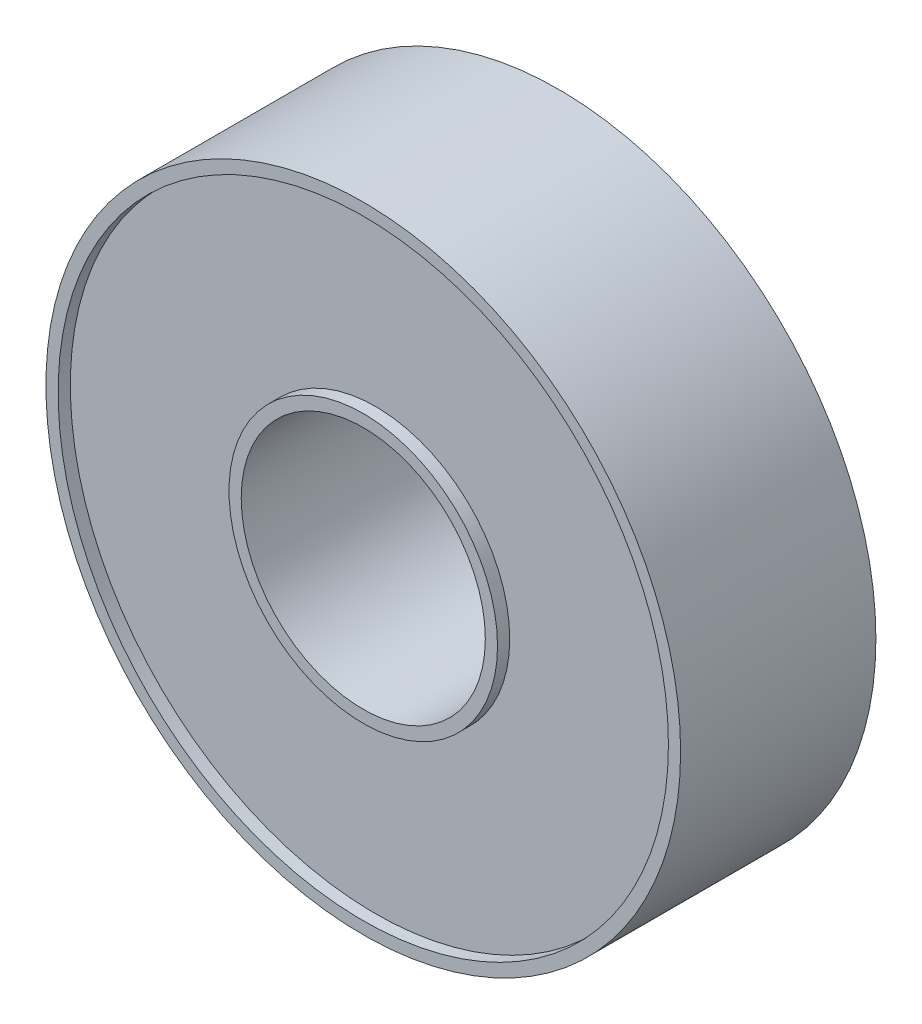
from build123d import *

# Parameters (mm, degrees)
SKETCH1_R           = 13
SKETCH1_R_2         = 5
BOSS_EXTRUDE1_DEPTH = 8
SKETCH2_R           = 12.5
SKETCH2_R_2         = 5.5
CUT_EXTRUDE1_DEPTH  = 0.5


with BuildPart() as part:
    # Sketch1 → Boss-Extrude1 (new body)
    with BuildSketch(Plane.XY):
        Circle(SKETCH1_R)
        Circle(SKETCH1_R_2, mode=Mode.SUBTRACT)
    extrude(amount=BOSS_EXTRUDE1_DEPTH)

    # Sketch2 → Cut-Extrude1 (cut)
    with BuildSketch(Plane.XY.offset(8)):
        Circle(SKETCH2_R)
        Circle(SKETCH2_R_2, mode=Mode.SUBTRACT)
    cut_extrude1 = extrude(amount=-CUT_EXTRUDE1_DEPTH, mode=Mode.SUBTRACT)

    # Mirror1: Cut-Extrude1 across plane
    add(cut_extrude1.mirror(Plane(origin=(0, 0, 4), x_dir=(1, 0, 0), z_dir=(0, 0, -1))), mode=Mode.SUBTRACT)


solid = part.part
